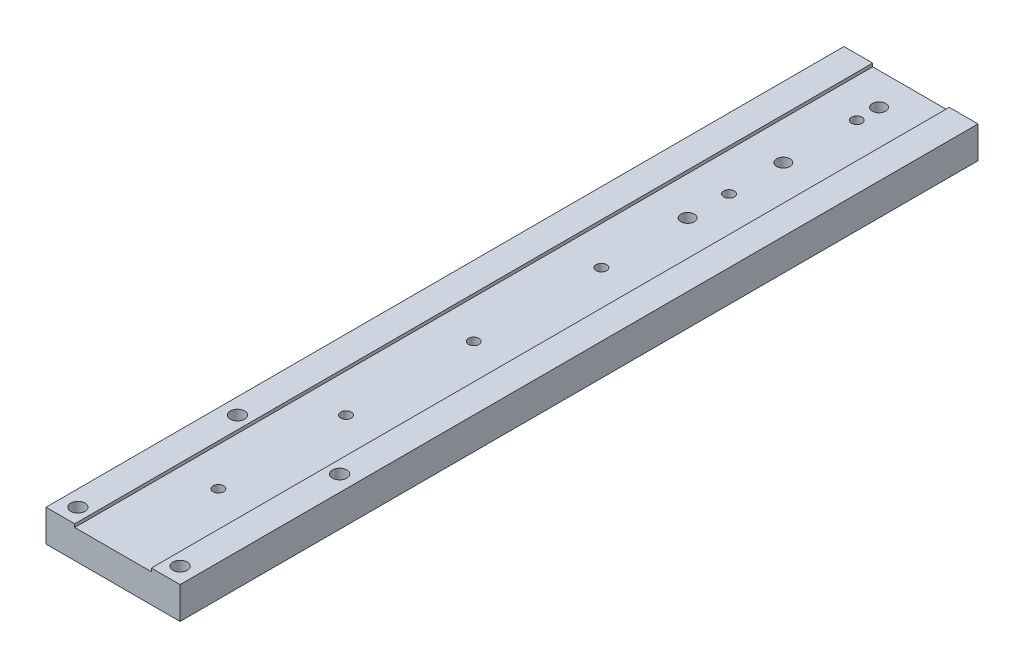
from build123d import *

# Parameters (mm, degrees)
SKETCH_1_W                = 42
SKETCH_1_H                = 250
EXTRUDE_1_DEPTH           = 10
SKETCH_10_W               = 24
SKETCH_10_H               = 1
CUT_EXTRUDE_1_DEPTH       = 252.079668631
HOLE_WIZARD_M4_1_D        = 3.3
PATTERN_LINEAR_1_COUNT    = 6
PATTERN_LINEAR_1_PITCH    = 40
HOLE_WIZARD_M5_1_D        = 4.2
HOLE_WIZARD_1_D           = 4.5
HOLE_WIZARD_1_CBORE_D     = 8
HOLE_WIZARD_1_CBORE_DEPTH = 4.6
HOLE_WIZARD_M5_2_D        = 4.2
HOLE_WIZARD_M5_2_DEPTH    = 12.4
HOLE_WIZARD_M5_2_TIP      = 1.2618073


with BuildPart() as part:
    # 草图1 → 凸台-拉伸1 (new body)
    with BuildSketch(Plane(origin=(0, 0, 0), x_dir=(1, 0, 0), z_dir=(0, 1, 0))):
        Rectangle(SKETCH_1_W, SKETCH_1_H)
    extrude(amount=EXTRUDE_1_DEPTH)

    # 草图10 → 切除-拉伸1 (cut, through all)
    with BuildSketch(Plane(origin=(0, 0, -125), x_dir=(-1, 0, 0), z_dir=(0, 0, -1))):
        with Locations((0, 9.5)):
            Rectangle(SKETCH_10_W, SKETCH_10_H)
    extrude(amount=-CUT_EXTRUDE_1_DEPTH, mode=Mode.SUBTRACT)

    # M4 螺纹孔1 (through all)
    with Locations(Plane(origin=(-1.725383056, 9, -76.289623168), x_dir=(1, 0, 0), z_dir=(0, 1, 0))):
        with Locations((1.725383056, 31.710376832)):
            hole_wizard_m4_1 = Hole(HOLE_WIZARD_M4_1_D / 2)

    # 阵列(线性)1: M4 螺纹孔1 ×6
    with Locations(*[(0, 0, i * PATTERN_LINEAR_1_PITCH) for i in range(1, PATTERN_LINEAR_1_COUNT)]):
        add(hole_wizard_m4_1, mode=Mode.SUBTRACT)

    # M5 螺纹孔1 (through all)
    with Locations(Plane(origin=(0, 0, 0), x_dir=(-1, 0, 0), z_dir=(0, -1, 0))):
        with Locations((0, 55), (0, 115), (0, 85)):
            Hole(HOLE_WIZARD_M5_1_D / 2)

    # 打孔尺寸根据内六角圆柱头螺钉的类型1 (through all)
    with Locations(Plane(origin=(0, 0, 0), x_dir=(-1, 0, 0), z_dir=(0, -1, 0))):
        with Locations((16, -120), (16, -70), (-16, -70), (-16, -120)):
            CounterBoreHole(HOLE_WIZARD_1_D / 2, HOLE_WIZARD_1_CBORE_D / 2, HOLE_WIZARD_1_CBORE_DEPTH)

    # M5 螺纹孔2
    with Locations(Plane(origin=(0, 0, -125), x_dir=(-1, 0, 0), z_dir=(0, 0, -1))):
        with Locations((-15, 5), (15, 5)):
            Hole(HOLE_WIZARD_M5_2_D / 2, depth=HOLE_WIZARD_M5_2_DEPTH)
            with Locations((0, 0, -(HOLE_WIZARD_M5_2_DEPTH + HOLE_WIZARD_M5_2_TIP / 2))):  # 118° drill point
                Cone(0, HOLE_WIZARD_M5_2_D / 2, HOLE_WIZARD_M5_2_TIP, mode=Mode.SUBTRACT)


solid = part.part
